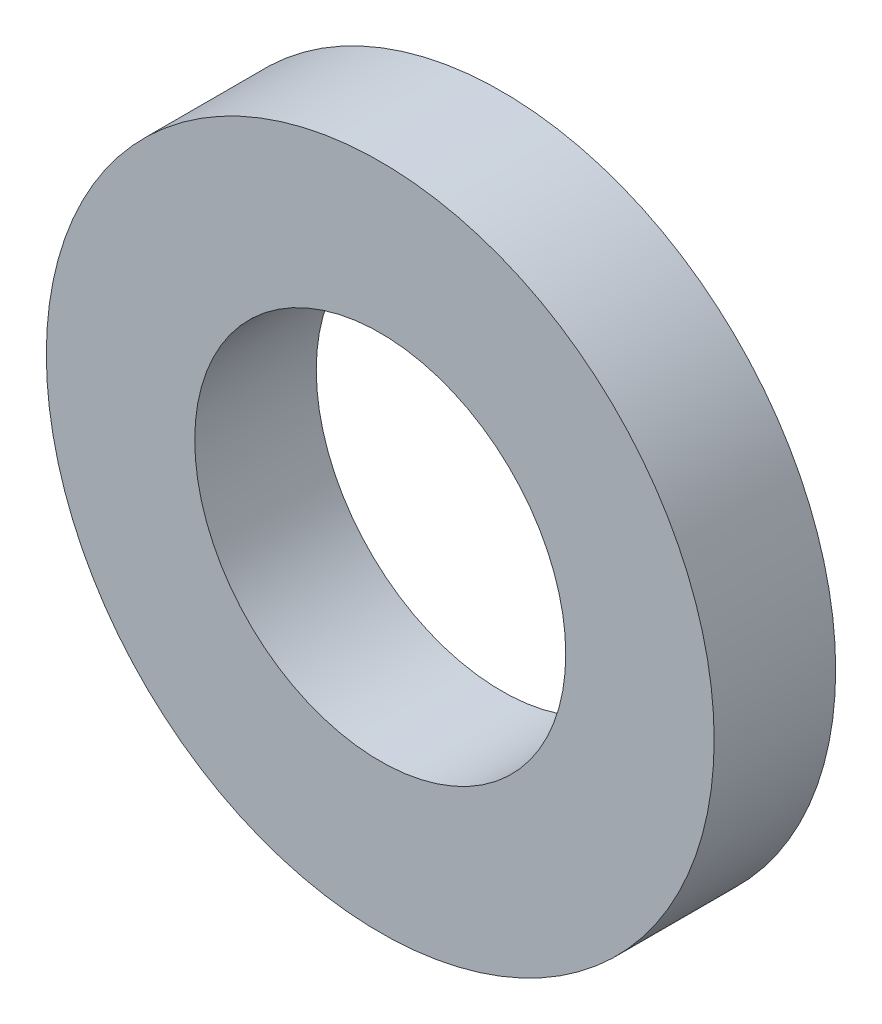
from build123d import *

# Parameters (mm, degrees)
SKETCH1_R           = 4.5
SKETCH1_R_2         = 2.5
BOSS_EXTRUDE1_DEPTH = 0.81875


with BuildPart() as part:
    # Sketch1 → Boss-Extrude1 (new, symmetric)
    with BuildSketch(Plane.XY):
        Circle(SKETCH1_R)
        Circle(SKETCH1_R_2, mode=Mode.SUBTRACT)
    extrude(amount=BOSS_EXTRUDE1_DEPTH, both=True)


solid = part.part
